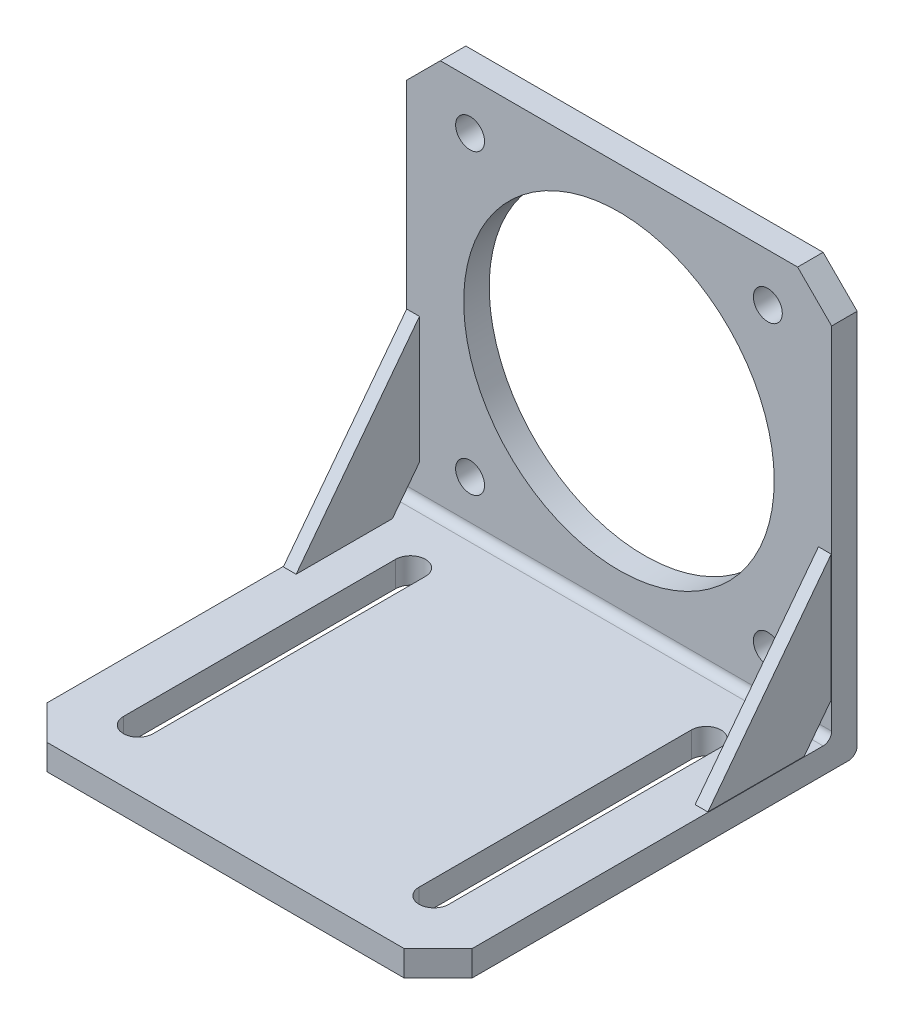
from build123d import *

# Parameters (mm, degrees)
SKETCH1_W           = 100
SKETCH1_H           = 98.5
SKETCH1_R           = 36.5
SKETCH1_R_2         = 3.4
BOSS_EXTRUDE1_DEPTH = 6
SKETCH2_W           = 100
SKETCH2_H           = 6
BOSS_EXTRUDE2_DEPTH = 92.5
CHAMFER1_SIZE       = 8
CUT_EXTRUDE1_DEPTH  = 145.078103819
BOSS_EXTRUDE3_START = -0.1
BOSS_EXTRUDE3_DEPTH = 3
BOSS_EXTRUDE4_START = -0.1
BOSS_EXTRUDE4_DEPTH = 3
FILLET1_R           = 2


with BuildPart() as part:
    # Sketch1 → Boss-Extrude1 (new body)
    with BuildSketch(Plane.XY):
        with Locations((0, 43.207953426)):
            Rectangle(SKETCH1_W, SKETCH1_H)
        with Locations((0, 46.207953426)):
            Circle(SKETCH1_R, mode=Mode.SUBTRACT)
        with Locations((-35, 81.207953426)):
            Circle(SKETCH1_R_2, mode=Mode.SUBTRACT)
        with Locations((35, 81.207953426)):
            Circle(SKETCH1_R_2, mode=Mode.SUBTRACT)
        with Locations((35, 11.207953426)):
            Circle(SKETCH1_R_2, mode=Mode.SUBTRACT)
        with Locations((-35, 11.207953426)):
            Circle(SKETCH1_R_2, mode=Mode.SUBTRACT)
    extrude(amount=BOSS_EXTRUDE1_DEPTH)

    # Sketch2 → Boss-Extrude2 (add)
    with BuildSketch(Plane.XY.offset(6)):
        with Locations((0, -3.042046574)):
            Rectangle(SKETCH2_W, SKETCH2_H)
    extrude(amount=BOSS_EXTRUDE2_DEPTH)

    # Chamfer1
    chamfer1_edges = [part.edges().sort_by_distance(p)[0] for p in [
        (-50, -3.042046574, 98.5),
        (50, -3.042046574, 98.5),
        (-50, 92.457953426, 3),
        (50, 92.457953426, 3),
    ]]
    chamfer(chamfer1_edges, length=CHAMFER1_SIZE)

    # Sketch3 → Cut-Extrude1 (cut, through all)
    with BuildSketch(Plane(origin=(0, -0.042046574, 0), x_dir=(1, 0, 0), z_dir=(0, 1, 0))):
        with BuildLine():
            Line((-38.25, -84.25), (-38.25, -20.25))
            ThreePointArc((-38.25, -20.25), (-34.75, -16.75), (-31.25, -20.25))
            Line((-31.25, -20.25), (-31.25, -84.25))
            ThreePointArc((-31.25, -84.25), (-34.75, -87.75), (-38.25, -84.25))
        make_face()
        with BuildLine():
            Line((38.25, -84.25), (38.25, -20.25))
            ThreePointArc((38.25, -20.25), (34.75, -16.75), (31.25, -20.25))
            Line((31.25, -20.25), (31.25, -84.25))
            ThreePointArc((31.25, -84.25), (34.75, -87.75), (38.25, -84.25))
        make_face()
    extrude(amount=-CUT_EXTRUDE1_DEPTH, mode=Mode.SUBTRACT)

    # Sketch4 → Boss-Extrude3 (add)
    with BuildSketch(Plane.ZY.offset(50).offset(BOSS_EXTRUDE3_START)):
        Polygon((6, 37.957953426), (35, -0.042046574), (12.357101974, -0.042046574), (6, 8.287949116), align=None)
    extrude(amount=-BOSS_EXTRUDE3_DEPTH)

    # Sketch5 → Boss-Extrude4 (add)
    with BuildSketch(Plane(origin=(50, 0, 0), x_dir=(0, 0, -1), z_dir=(1, 0, 0)).offset(BOSS_EXTRUDE4_START)):
        Polygon((-6, 8.287949116), (-6, 37.957953426), (-35, -0.042046574), (-12.357101974, -0.042046574), align=None)
    extrude(amount=-BOSS_EXTRUDE4_DEPTH)

    # Fillet1
    fillet1_edges = [part.edges().sort_by_distance(p)[0] for p in [
        (0, -0.042046574, 6),
        (0, -6.042046574, 0),
    ]]
    fillet(fillet1_edges, radius=FILLET1_R)


solid = part.part
